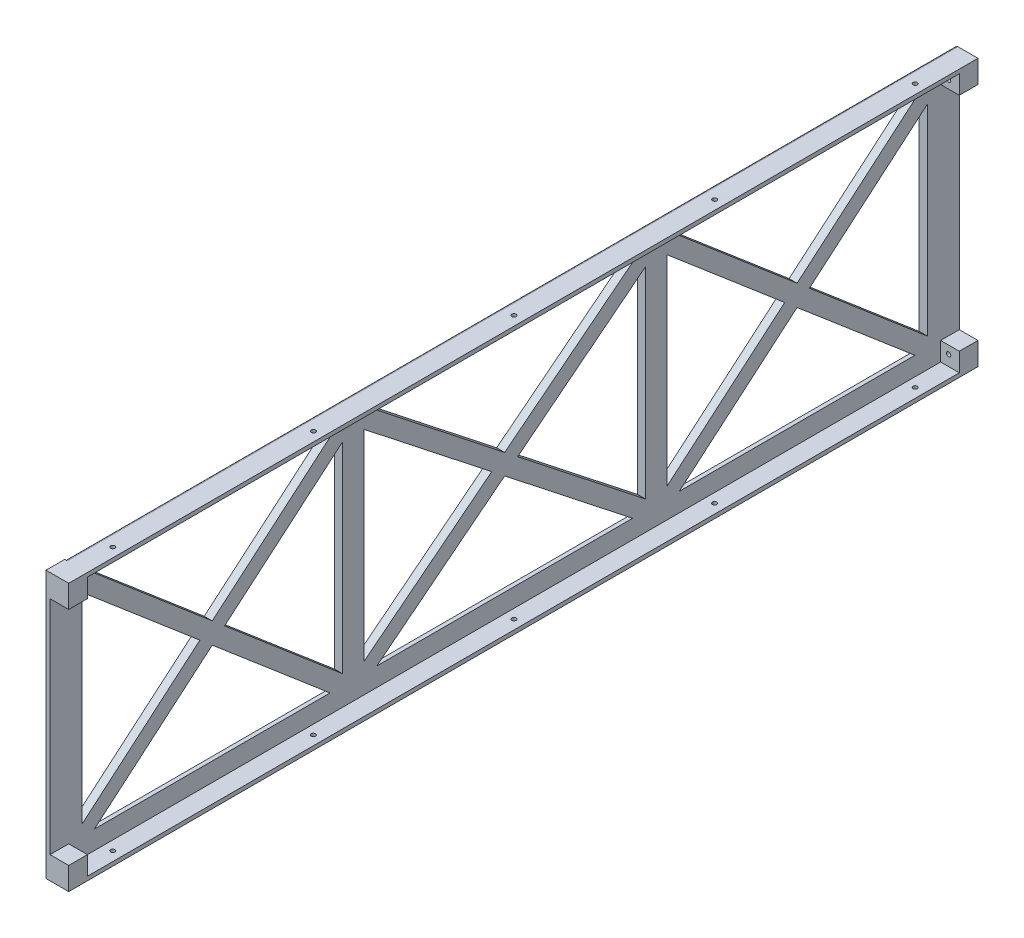
from build123d import *

# Parameters (mm, degrees)
PROFILE_DEPTH                               = 340.5
SKETCH2_W                                   = 8.5
SKETCH2_H                                   = 8.5
FEET_DEPTH                                  = 7
POCKETS_DEPTH                               = 355.98239393
RAIL_EDGE_R1_R                              = 1
M2_TAP_HOLES_SKETCH_R                       = 0.8
M2_TAP_HOLES_1_6_DRILL_DEPTH                = 355.98239393
FOOT_TAPS_SKETCH_Z0_END_R                   = 0.8
M2_FOOT_TAPS_1_6_DRILL_5_DEEP_Z0_END_DEPTH  = 5
M2_START                                    = -5
FOOT_TAPS_SKETCH_Z340_END_R                 = 0.8
M2_FOOT_TAPS_1_6_DRILL_5_DEEP_Z340_EN_DEPTH = 5
BRACES_DEPTH                                = 1.5
BRACES_2_DEPTH                              = 1.5
BRACES_OUTER_DEPTH                          = 1.5
BRACES_OUTER_2_DEPTH                        = 1.5
PANEL_PADS_SKETCH_W                         = 8
PANEL_PADS_SKETCH_H                         = 83
PANEL_PADS_DEPTH                            = 1.5


with BuildPart() as part:
    # Sketch1 → Profile (new body)
    with BuildSketch(Plane.XY):
        Polygon((0, 0), (0, 100), (8.5, 100), (8.5, 98.5), (1.5, 98.5), (1.5, 1.5), (8.5, 1.5), (8.5, 0), align=None)
    extrude(amount=PROFILE_DEPTH)

    # Sketch2 → Feet (add)
    with BuildSketch(Plane.XY):
        with Locations((4.25, 4.25)):
            Rectangle(SKETCH2_W, SKETCH2_H)
        with Locations((4.25, 95.75)):
            Rectangle(SKETCH2_W, SKETCH2_H)
    feet = extrude(amount=FEET_DEPTH)

    # Sketch5 → Pockets (cut, through all)
    with BuildSketch(Plane(origin=(0, 0, 0), x_dir=(0, 0, -1), z_dir=(1, 0, 0))):
        with BuildLine():
            Line((-15, 91.5), (-106.5, 91.5))
            ThreePointArc((-106.5, 91.5), (-108.621320344, 90.621320344), (-109.5, 88.5))
            Line((-109.5, 88.5), (-109.5, 11.5))
            ThreePointArc((-109.5, 11.5), (-108.621320344, 9.378679656), (-106.5, 8.5))
            Line((-106.5, 8.5), (-15, 8.5))
            ThreePointArc((-15, 8.5), (-12.878679656, 9.378679656), (-12, 11.5))
            Line((-12, 11.5), (-12, 88.5))
            ThreePointArc((-12, 88.5), (-12.878679656, 90.621320344), (-15, 91.5))
        make_face()
        with BuildLine():
            Line((-120.5, 91.5), (-220, 91.5))
            ThreePointArc((-220, 91.5), (-222.121320344, 90.621320344), (-223, 88.5))
            Line((-223, 88.5), (-223, 11.5))
            ThreePointArc((-223, 11.5), (-222.121320344, 9.378679656), (-220, 8.5))
            Line((-220, 8.5), (-120.5, 8.5))
            ThreePointArc((-120.5, 8.5), (-118.378679656, 9.378679656), (-117.5, 11.5))
            Line((-117.5, 11.5), (-117.5, 88.5))
            ThreePointArc((-117.5, 88.5), (-118.378679656, 90.621320344), (-120.5, 91.5))
        make_face()
        with BuildLine():
            Line((-234, 91.5), (-325.5, 91.5))
            ThreePointArc((-325.5, 91.5), (-327.621320344, 90.621320344), (-328.5, 88.5))
            Line((-328.5, 88.5), (-328.5, 11.5))
            ThreePointArc((-328.5, 11.5), (-327.621320344, 9.378679656), (-325.5, 8.5))
            Line((-325.5, 8.5), (-234, 8.5))
            ThreePointArc((-234, 8.5), (-231.878679656, 9.378679656), (-231, 11.5))
            Line((-231, 11.5), (-231, 88.5))
            ThreePointArc((-231, 88.5), (-231.878679656, 90.621320344), (-234, 91.5))
        make_face()
    extrude(amount=POCKETS_DEPTH, mode=Mode.SUBTRACT)

    # Rail Edge R1
    rail_edge_r1_edges = [part.edges().sort_by_distance(p)[0] for p in [
        (0, 0, 170.25),
        (0, 100, 170.25),
    ]]
    fillet(rail_edge_r1_edges, radius=RAIL_EDGE_R1_R)

    # Feet Mirror: Feet across plane
    add(feet.mirror(Plane.XY.offset(170.25)))

    # M2 tap holes sketch → M2 Tap Holes (1.6 drill) (cut, through all)
    with BuildSketch(Plane.XZ):
        with Locations((5, 20)):
            Circle(M2_TAP_HOLES_SKETCH_R)
        with Locations((5, 95.125)):
            Circle(M2_TAP_HOLES_SKETCH_R)
        with Locations((5, 170.25)):
            Circle(M2_TAP_HOLES_SKETCH_R)
        with Locations((5, 245.375)):
            Circle(M2_TAP_HOLES_SKETCH_R)
        with Locations((5, 320.5)):
            Circle(M2_TAP_HOLES_SKETCH_R)
    extrude(amount=-M2_TAP_HOLES_1_6_DRILL_DEPTH, mode=Mode.SUBTRACT)

    # Foot taps sketch z0 end → M2 Foot Taps (1.6 drill, 5 deep) z0 end (cut)
    with BuildSketch(Plane.XY.offset(7)):
        with Locations((4.5, 5.5)):
            Circle(FOOT_TAPS_SKETCH_Z0_END_R)
        with Locations((4.5, 94.5)):
            Circle(FOOT_TAPS_SKETCH_Z0_END_R)
    extrude(amount=-M2_FOOT_TAPS_1_6_DRILL_5_DEEP_Z0_END_DEPTH, mode=Mode.SUBTRACT)

    # Foot taps sketch z340 end → M2 Foot Taps (1.6 drill, 5 deep) z340 end (cut)
    with BuildSketch(Plane(origin=(0, 0, 333.5), x_dir=(-1, 0, 0), z_dir=(0, 0, -1)).offset(M2_START)):
        with Locations(Location((-4.5, 5.5, 0), (0, 0, 180))):
            Circle(FOOT_TAPS_SKETCH_Z340_END_R)
        with Locations(Location((-4.5, 94.5, 0), (0, 0, 180))):
            Circle(FOOT_TAPS_SKETCH_Z340_END_R)
    extrude(amount=M2_FOOT_TAPS_1_6_DRILL_5_DEEP_Z340_EN_DEPTH, mode=Mode.SUBTRACT)

    # Braces _ sketch → Braces (add)
    with BuildSketch(Plane.ZY):
        Polygon((13.944644974, 6.215627892), (111.444644974, 89.215627892), (107.555355026, 93.784372108), (10.055355026, 10.784372108), align=None)
        Polygon((119.354944806, 6.14220871), (224.854944806, 89.14220871), (221.145055194, 93.85779129), (115.645055194, 10.85779129), align=None)
        Polygon((232.944644974, 6.215627892), (330.444644974, 89.215627892), (326.555355026, 93.784372108), (229.055355026, 10.784372108), align=None)
    extrude(amount=-BRACES_DEPTH)

    # Braces _ sketch 2 → Braces 2 (add)
    with BuildSketch(Plane.ZY):
        Polygon((10.055355026, 89.215627892), (107.555355026, 6.215627892), (111.444644974, 10.784372108), (13.944644974, 93.784372108), align=None)
        Polygon((115.645055194, 89.14220871), (221.145055194, 6.14220871), (224.854944806, 10.85779129), (119.354944806, 93.85779129), align=None)
        Polygon((229.055355026, 89.215627892), (326.555355026, 6.215627892), (330.444644974, 10.784372108), (232.944644974, 93.784372108), align=None)
    extrude(amount=-BRACES_2_DEPTH)

    # Braces _ outer sketch → Braces _ outer (add)
    with BuildSketch(Plane.ZY):
        Polygon((13.944644974, 6.215627892), (111.444644974, 89.215627892), (107.555355026, 93.784372108), (10.055355026, 10.784372108), align=None)
        Polygon((119.354944806, 6.14220871), (224.854944806, 89.14220871), (221.145055194, 93.85779129), (115.645055194, 10.85779129), align=None)
        Polygon((232.944644974, 6.215627892), (330.444644974, 89.215627892), (326.555355026, 93.784372108), (229.055355026, 10.784372108), align=None)
    extrude(amount=BRACES_OUTER_DEPTH)

    # Braces _ outer sketch 2 → Braces _ outer 2 (add)
    with BuildSketch(Plane.ZY):
        Polygon((10.055355026, 89.215627892), (107.555355026, 6.215627892), (111.444644974, 10.784372108), (13.944644974, 93.784372108), align=None)
        Polygon((115.645055194, 89.14220871), (221.145055194, 6.14220871), (224.854944806, 10.85779129), (119.354944806, 93.85779129), align=None)
        Polygon((229.055355026, 89.215627892), (326.555355026, 6.215627892), (330.444644974, 10.784372108), (232.944644974, 93.784372108), align=None)
    extrude(amount=BRACES_OUTER_2_DEPTH)

    # Panel pads sketch → Panel pads (add)
    with BuildSketch(Plane.ZY):
        with Locations((8, 50)):
            Rectangle(PANEL_PADS_SKETCH_W, PANEL_PADS_SKETCH_H)
        with Locations((113.5, 50)):
            Rectangle(PANEL_PADS_SKETCH_W, PANEL_PADS_SKETCH_H)
        with Locations((227, 50)):
            Rectangle(PANEL_PADS_SKETCH_W, PANEL_PADS_SKETCH_H)
        with Locations((332.5, 50)):
            Rectangle(PANEL_PADS_SKETCH_W, PANEL_PADS_SKETCH_H)
    extrude(amount=PANEL_PADS_DEPTH)


solid = part.part
